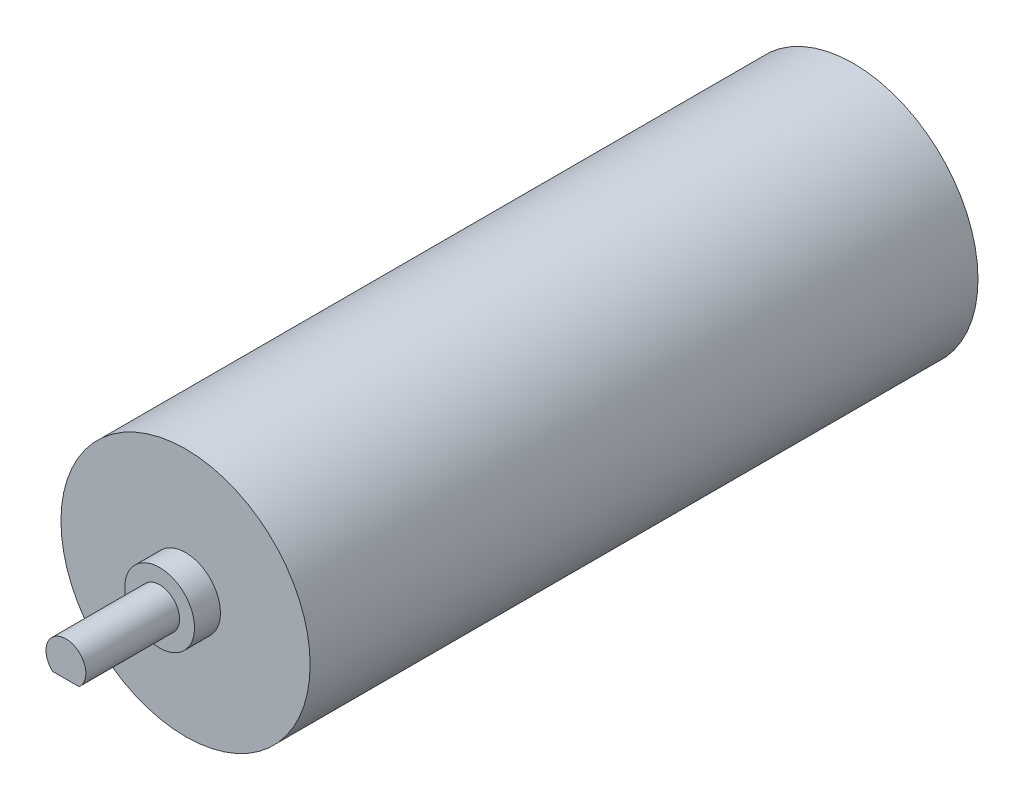
from build123d import *

# Parameters (mm, degrees)
SKETCH1_R           = 2
BOSS_EXTRUDE1_DEPTH = 9.4
SKETCH2_W           = 6
SKETCH2_H           = 0.5
CUT_EXTRUDE1_DEPTH  = 8
SKETCH3_R           = 3.5
BOSS_EXTRUDE2_DEPTH = 2.6
SKETCH4_R           = 12.5
SKETCH4_R_2         = 12.4
EXTRUDE_THIN1_DEPTH = 67
SKETCH6_R           = 12.5
BOSS_EXTRUDE4_DEPTH = 0.1
BOSS_EXTRUDE5_START = -0.1
SKETCH7_R           = 12.5
BOSS_EXTRUDE5_DEPTH = 0.1


with BuildPart() as part:
    # Sketch1 → Boss-Extrude1 (new body)
    with BuildSketch(Plane.XY):
        Circle(SKETCH1_R)
    extrude(amount=-BOSS_EXTRUDE1_DEPTH)

    # Sketch2 → Cut-Extrude1 (cut)
    with BuildSketch(Plane.XY):
        with Locations((0.35899941, -1.75)):
            Rectangle(SKETCH2_W, SKETCH2_H)
    extrude(amount=-CUT_EXTRUDE1_DEPTH, mode=Mode.SUBTRACT)

    # Sketch3 → Boss-Extrude2 (add)
    with BuildSketch(Plane(origin=(0, 0, -9.4), x_dir=(-1, 0, 0), z_dir=(0, 0, -1))):
        Circle(SKETCH3_R)
    extrude(amount=BOSS_EXTRUDE2_DEPTH)



with BuildPart() as body_2:
    # Sketch4 → Extrude-Thin1 (new body)
    with BuildSketch(Plane(origin=(0, 0, -12), x_dir=(-1, 0, 0), z_dir=(0, 0, -1))):
        Circle(SKETCH4_R)
        Circle(SKETCH4_R_2, mode=Mode.SUBTRACT)
    extrude(amount=EXTRUDE_THIN1_DEPTH)


with BuildPart() as part_1:
    add(part.part)

    add(body_2.part)  # Boss-Extrude4 merges body 2
    # Sketch6 → Boss-Extrude4 (add)
    with BuildSketch(Plane(origin=(0, 0, -12), x_dir=(-1, 0, 0), z_dir=(0, 0, -1))):
        Circle(SKETCH6_R)
    extrude(amount=BOSS_EXTRUDE4_DEPTH)

    # Sketch7 → Boss-Extrude5 (add)
    with BuildSketch(Plane(origin=(0, 0, -79), x_dir=(-1, 0, 0), z_dir=(0, 0, -1)).offset(BOSS_EXTRUDE5_START)):
        Circle(SKETCH7_R)
    extrude(amount=BOSS_EXTRUDE5_DEPTH)


solid = part_1.part
